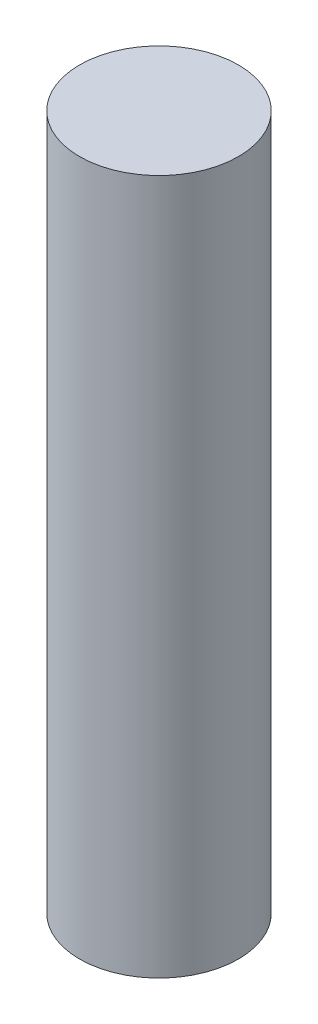
from build123d import *

# Parameters (mm, degrees)
SKETCH1_R           = 4
BOSS_EXTRUDE1_DEPTH = 17.5


with BuildPart() as part:
    # Sketch1 → Boss-Extrude1 (new, symmetric)
    with BuildSketch(Plane(origin=(0, 0, 0), x_dir=(1, 0, 0), z_dir=(0, 1, 0))):
        with Locations(Location((0, 0, 0), (0, 0, 270))):
            Circle(SKETCH1_R)
    extrude(amount=BOSS_EXTRUDE1_DEPTH, both=True)


solid = part.part
